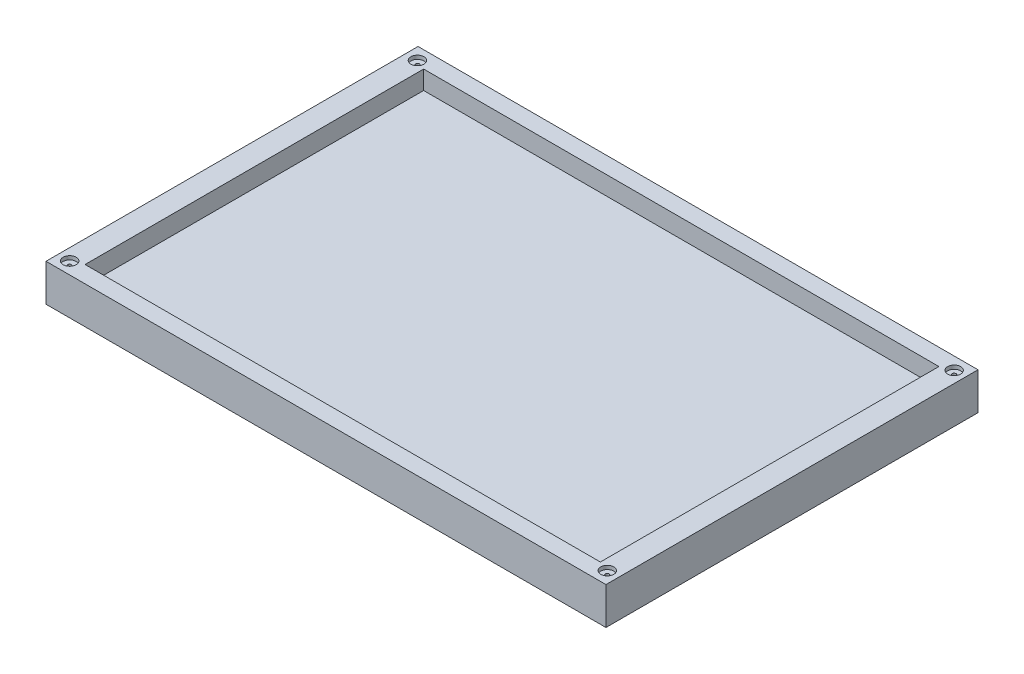
from build123d import *

# Parameters (mm, degrees)
SKETCH1_W           = 150.5
SKETCH1_H           = 100
BOSS_EXTRUDE1_DEPTH = 5
SKETCH2_W           = 138.5
SKETCH2_H           = 91
CUT_EXTRUDE1_DEPTH  = 5
SKETCH3_R           = 1.75
CUT_EXTRUDE2_DEPTH  = 1
SKETCH4_R           = 0.5
CUT_EXTRUDE3_DEPTH  = 5


with BuildPart() as part:
    # Sketch1 → Boss-Extrude1 (new, symmetric)
    with BuildSketch(Plane(origin=(0, 0, 0), x_dir=(1, 0, 0), z_dir=(0, 1, 0))):
        with Locations((75.25, 50)):
            Rectangle(SKETCH1_W, SKETCH1_H)
    extrude(amount=BOSS_EXTRUDE1_DEPTH, both=True)

    # Sketch2 → Cut-Extrude1 (cut)
    with BuildSketch(Plane(origin=(0, 5, 0), x_dir=(1, 0, 0), z_dir=(0, 1, 0))):
        with Locations((75.25, 50)):
            Rectangle(SKETCH2_W, SKETCH2_H)
    extrude(amount=-CUT_EXTRUDE1_DEPTH, mode=Mode.SUBTRACT)

    # Sketch3 → Cut-Extrude2 (cut)
    with BuildSketch(Plane(origin=(0, 5, 0), x_dir=(1, 0, 0), z_dir=(0, 1, 0))):
        with Locations(Location((3.159079735, 96.662135708, 0), (0, 0, 270))):
            Circle(SKETCH3_R)
        with Locations(Location((3.102788334, 3.254527641, 0), (0, 0, 270))):
            Circle(SKETCH3_R)
        with Locations(Location((147.430623058, 3.436900869, 0), (0, 0, 270))):
            Circle(SKETCH3_R)
        with Locations(Location((147.430623058, 96.662135708, 0), (0, 0, 270))):
            Circle(SKETCH3_R)
    extrude(amount=-CUT_EXTRUDE2_DEPTH, mode=Mode.SUBTRACT)

    # Sketch4 → Cut-Extrude3 (cut)
    with BuildSketch(Plane(origin=(0, 4, 0), x_dir=(1, 0, 0), z_dir=(0, 1, 0))):
        with Locations(Location((3.212524906, 96.64723106, 0), (0, 0, 270))):
            Circle(SKETCH4_R)
        with Locations(Location((3.17577296, 3.128534438, 0), (0, 0, 270))):
            Circle(SKETCH4_R)
        with Locations(Location((147.423404744, 3.438562915, 0), (0, 0, 270))):
            Circle(SKETCH4_R)
        with Locations(Location((147.430623058, 96.662135708, 0), (0, 0, 270))):
            Circle(SKETCH4_R)
    extrude(amount=-CUT_EXTRUDE3_DEPTH, mode=Mode.SUBTRACT)


solid = part.part
